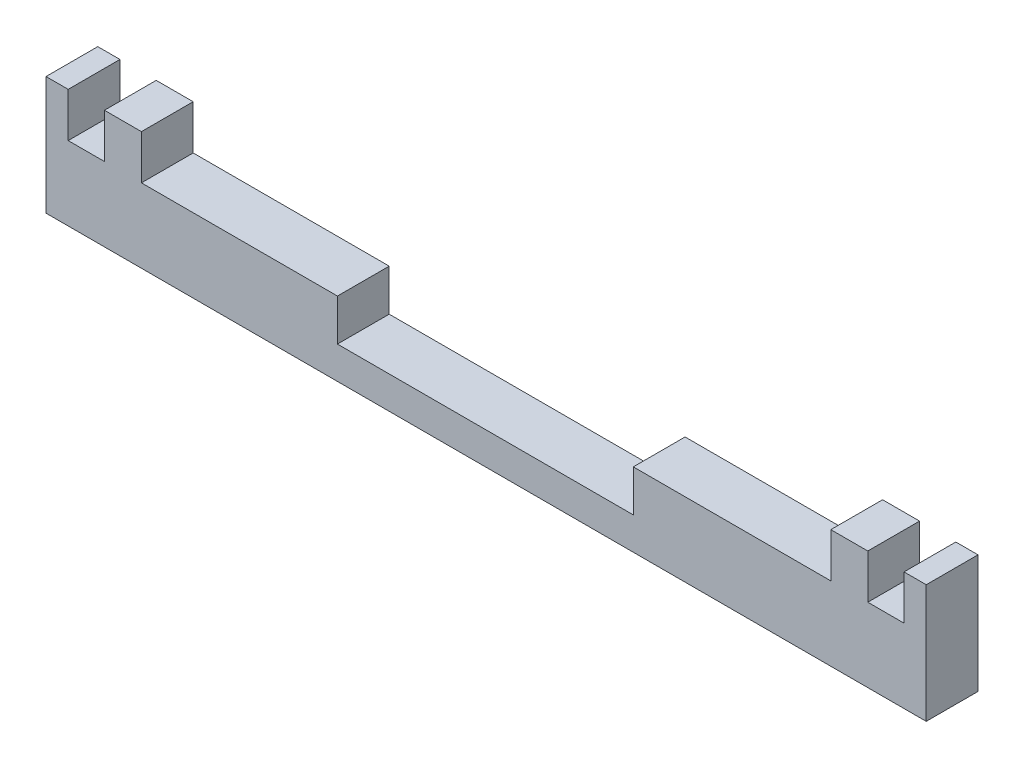
from build123d import *

# Parameters (mm, degrees)
BOSS_EXTRUDE1_DEPTH = 8.89
SKETCH2_W           = 50.8
SKETCH2_H           = 7.14375
CUT_EXTRUDE1_DEPTH  = 8.89


with BuildPart() as part:
    # Sketch1 → Boss-Extrude1 (new body)
    with BuildSketch(Plane.XY):
        Polygon((-95.447161757, -23.697149871), (55.682838243, -23.697149871), (55.682838243, -3.377149871), (51.872838243, -3.377149871), (51.872838243, -10.997149871), (45.649838243, -10.997149871), (45.649838243, -3.377149871), (39.299838243, -3.377149871), (39.299838243, -10.997149871), (-79.064161757, -10.997149871), (-79.064161757, -3.377149871), (-85.414161757, -3.377149871), (-85.414161757, -10.997149871), (-91.637161757, -10.997149871), (-91.637161757, -3.377149871), (-95.447161757, -3.377149871), align=None)
    extrude(amount=BOSS_EXTRUDE1_DEPTH)

    # Sketch2 → Cut-Extrude1 (cut)
    with BuildSketch(Plane.XY.offset(8.89)):
        with Locations((-20.009161757, -14.569024871)):
            Rectangle(SKETCH2_W, SKETCH2_H)
    extrude(amount=-CUT_EXTRUDE1_DEPTH, mode=Mode.SUBTRACT)


solid = part.part
